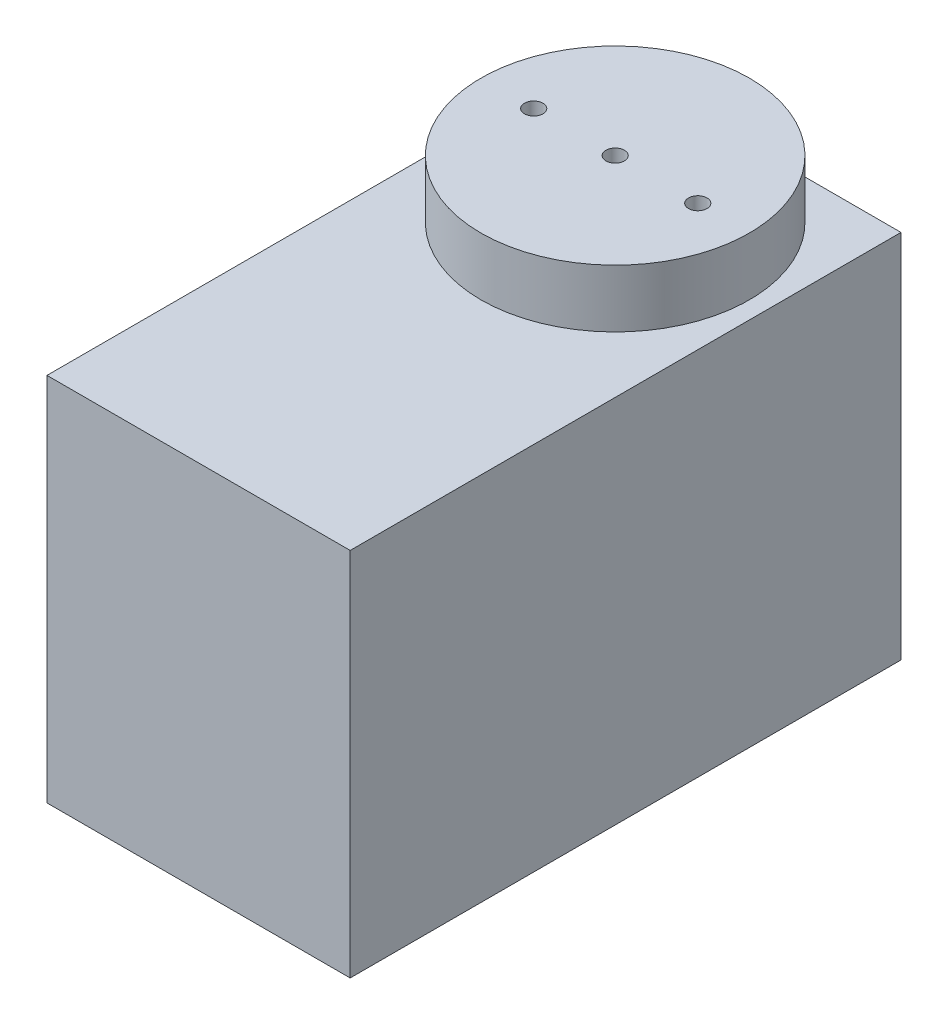
from build123d import *

# Parameters (mm, degrees)
SKETCH1_W                 = 26.2
SKETCH1_H                 = 47.6
BOSS_EXTRUDE1_DEPTH       = 32
SKETCH2_R                 = 11.6
BOSS_EXTRUDE2_DEPTH       = 5
M2X0_4_TAPPED_HOLE1_D     = 1.6
M2X0_4_TAPPED_HOLE1_DEPTH = 5.2
M2X0_4_TAPPED_HOLE1_TIP   = 0.480688495


with BuildPart() as part:
    # Sketch1 → Boss-Extrude1 (new body)
    with BuildSketch(Plane(origin=(0, 0, 0), x_dir=(1, 0, 0), z_dir=(0, 1, 0))):
        Rectangle(SKETCH1_W, SKETCH1_H)
    extrude(amount=BOSS_EXTRUDE1_DEPTH)

    # Sketch2 → Boss-Extrude2 (add)
    with BuildSketch(Plane(origin=(0, 32, 0), x_dir=(-1, 0, 0), z_dir=(0, 1, 0))):
        with Locations(Location((0, -12.2, 0), (0, 0, 270))):
            Circle(SKETCH2_R)
    extrude(amount=BOSS_EXTRUDE2_DEPTH)

    # M2x0.4 Tapped Hole1
    with Locations(Plane(origin=(0, 37, -12.2), x_dir=(0, 0, 1), z_dir=(0, 1, 0))):
        with Locations((0, 0), (0, -7.039859919), (0, 7.136767925)):
            Hole(M2X0_4_TAPPED_HOLE1_D / 2, depth=M2X0_4_TAPPED_HOLE1_DEPTH)
            with Locations((0, 0, -(M2X0_4_TAPPED_HOLE1_DEPTH + M2X0_4_TAPPED_HOLE1_TIP / 2))):  # 118° drill point
                Cone(0, M2X0_4_TAPPED_HOLE1_D / 2, M2X0_4_TAPPED_HOLE1_TIP, mode=Mode.SUBTRACT)


solid = part.part
